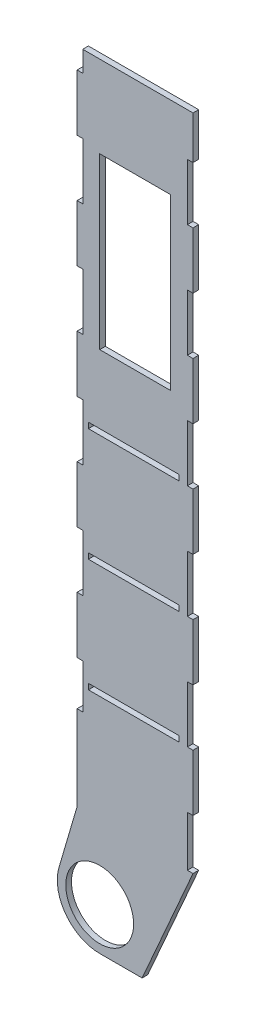
from build123d import *

# Parameters (mm, degrees)
SKETCH_1_R      = 12
SKETCH_1_W      = 32
SKETCH_1_H      = 2
SKETCH_1_W_2    = 25
SKETCH_1_H_2    = 60
EXTRUDE_1_DEPTH = 2


with BuildPart() as part:
    # 草图1 → 凸台-拉伸1 (new body)
    with BuildSketch(Plane.XY):
        with BuildLine():
            Line((-8, -48.342527861), (-6, -48.342527861))
            Line((-6, -48.342527861), (-6, -68.342527861))
            Line((-6, -68.342527861), (-8, -68.342527861))
            Line((-8, -68.342527861), (-8, -88.342527861))
            Line((-8, -88.342527861), (-6, -88.342527861))
            Line((-6, -88.342527861), (-6, -108.342527861))
            Line((-6, -108.342527861), (-8, -108.342527861))
            Line((-8, -108.342527861), (-8, -128.342527861))
            Line((-8, -128.342527861), (-6, -128.342527861))
            Line((-6, -128.342527861), (-6, -144.000000011))
            Line((-6, -144.000000011), (-8, -144.000000011))
            Line((-8, -144.000000011), (-8, -174))
            Line((-8, -174), (-14.392579, -195.774639692))
            ThreePointArc((-14.392579, -195.774639692), (-12.007922481, -208.989426995), (0, -215))
            Line((0, -215), (15, -215))
            Line((15, -215), (33, -174))
            Line((33, -174), (31, -174))
            Line((31, -174), (31, -156.221540553))
            Line((31, -156.221540553), (33, -156.221540553))
            Line((33, -156.221540553), (33, -136.221540553))
            Line((33, -136.221540553), (31, -136.221540553))
            Line((31, -136.221540553), (31, -116.221540553))
            Line((31, -116.221540553), (33, -116.221540553))
            Line((33, -116.221540553), (33, -96.221540553))
            Line((33, -96.221540553), (31, -96.221540553))
            Line((31, -96.221540553), (31, -76.221540553))
            Line((31, -76.221540553), (33, -76.221540553))
            Line((33, -76.221540553), (33, -56.221540553))
            Line((33, -56.221540553), (31, -56.221540553))
            Line((31, -56.221540553), (31, -36.221540553))
            Line((31, -36.221540553), (33, -36.221540553))
            Line((33, -36.221540553), (33, -16.221540553))
            Line((33, -16.221540553), (31, -16.221540553))
            Line((31, -16.221540553), (31, 3.778459447))
            Line((31, 3.778459447), (33, 3.778459447))
            Line((33, 3.778459447), (33, 23.778459447))
            Line((33, 23.778459447), (31, 23.778459447))
            Line((31, 23.778459447), (31, 43.778459447))
            Line((31, 43.778459447), (33, 43.778459447))
            Line((33, 43.778459447), (33, 49))
            Line((33, 49), (33, 59))
            Line((33, 59), (-6, 59))
            Line((-6, 59), (-6, 51.657472139))
            Line((-6, 51.657472139), (-8, 51.657472139))
            Line((-8, 51.657472139), (-8, 31.657472139))
            Line((-8, 31.657472139), (-6, 31.657472139))
            Line((-6, 31.657472139), (-6, 11.657472139))
            Line((-6, 11.657472139), (-8, 11.657472139))
            Line((-8, 11.657472139), (-8, -8.342527861))
            Line((-8, -8.342527861), (-6, -8.342527861))
            Line((-6, -8.342527861), (-6, -28.342527861))
            Line((-6, -28.342527861), (-8, -28.342527861))
            Line((-8, -28.342527861), (-8, -48.342527861))
        make_face()
        with Locations((0, -200)):
            Circle(SKETCH_1_R, mode=Mode.SUBTRACT)
        with Locations((12, -55.221540553)):
            Rectangle(SKETCH_1_W, SKETCH_1_H, mode=Mode.SUBTRACT)
        with Locations((12, -95.221540553)):
            Rectangle(SKETCH_1_W, SKETCH_1_H, mode=Mode.SUBTRACT)
        with Locations((12, -135.221540553)):
            Rectangle(SKETCH_1_W, SKETCH_1_H, mode=Mode.SUBTRACT)
        with Locations((12.5, 0)):
            Rectangle(SKETCH_1_W_2, SKETCH_1_H_2, mode=Mode.SUBTRACT)
    extrude(amount=EXTRUDE_1_DEPTH)


solid = part.part
